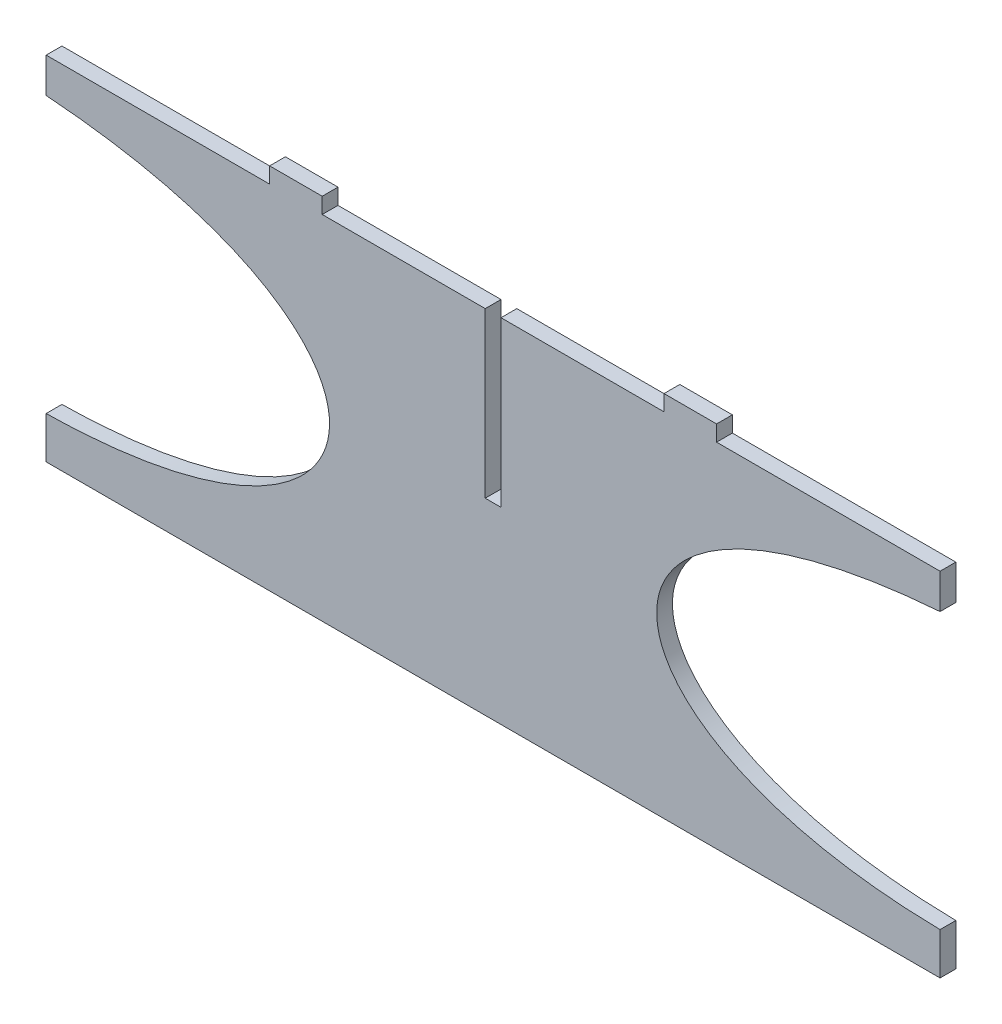
from build123d import *

# Parameters (mm, degrees)
RESSALTO_EXTRUS_O1_DEPTH = 2


with BuildPart() as part:
    # Model → Ressalto-extrusão1 (new body)
    with BuildSketch(Plane.XY):
        with BuildLine():
            Line((-58.8502, -40.6768), (-58.8502, -45.1121))
            add(Edge.make_bspline(
                [(-58.8502, -45.1121), (-9.0376, -48.8189), (-12.8956, -79.3194), (-58.8502, -80.0274)],
                knots=[0.047619048, 0.047619048, 0.047619048, 0.047619048, 0.095238095, 0.095238095, 0.095238095, 0.095238095], degree=3))
            Line((-58.8502, -80.0274), (-58.8502, -85.3435))
            Line((-58.8502, -85.3435), (54.4831, -85.3435))
            Line((54.4831, -85.3435), (54.4831, -80.0274))
            add(Edge.make_bspline(
                [(54.4831, -80.0274), (8.5266, -79.3193), (4.6696, -48.8189), (54.4831, -45.1121)],
                knots=[0.238095238, 0.238095238, 0.238095238, 0.238095238, 0.285714286, 0.285714286, 0.285714286, 0.285714286], degree=3))
            Line((54.4831, -45.1121), (54.4831, -40.6768))
            Line((54.4831, -40.6768), (26.1498, -40.6768))
            Line((26.1498, -40.6768), (26.1498, -38.6717))
            Line((26.1498, -38.6717), (19.4831, -38.6717))
            Line((19.4831, -38.6717), (19.4831, -40.6768))
            Line((19.4831, -40.6768), (-1.1835, -40.6768))
            Line((-1.1835, -40.6768), (-1.1835, -61.4949))
            Line((-1.1835, -61.4949), (-3.1835, -61.4949))
            Line((-3.1835, -61.4949), (-3.1835, -40.6768))
            Line((-3.1835, -40.6768), (-23.8502, -40.6768))
            Line((-23.8502, -40.6768), (-23.8502, -38.6717))
            Line((-23.8502, -38.6717), (-30.5169, -38.6717))
            Line((-30.5169, -38.6717), (-30.5169, -40.6768))
            Line((-30.5169, -40.6768), (-58.8502, -40.6768))
        make_face()
    extrude(amount=RESSALTO_EXTRUS_O1_DEPTH)


solid = part.part
